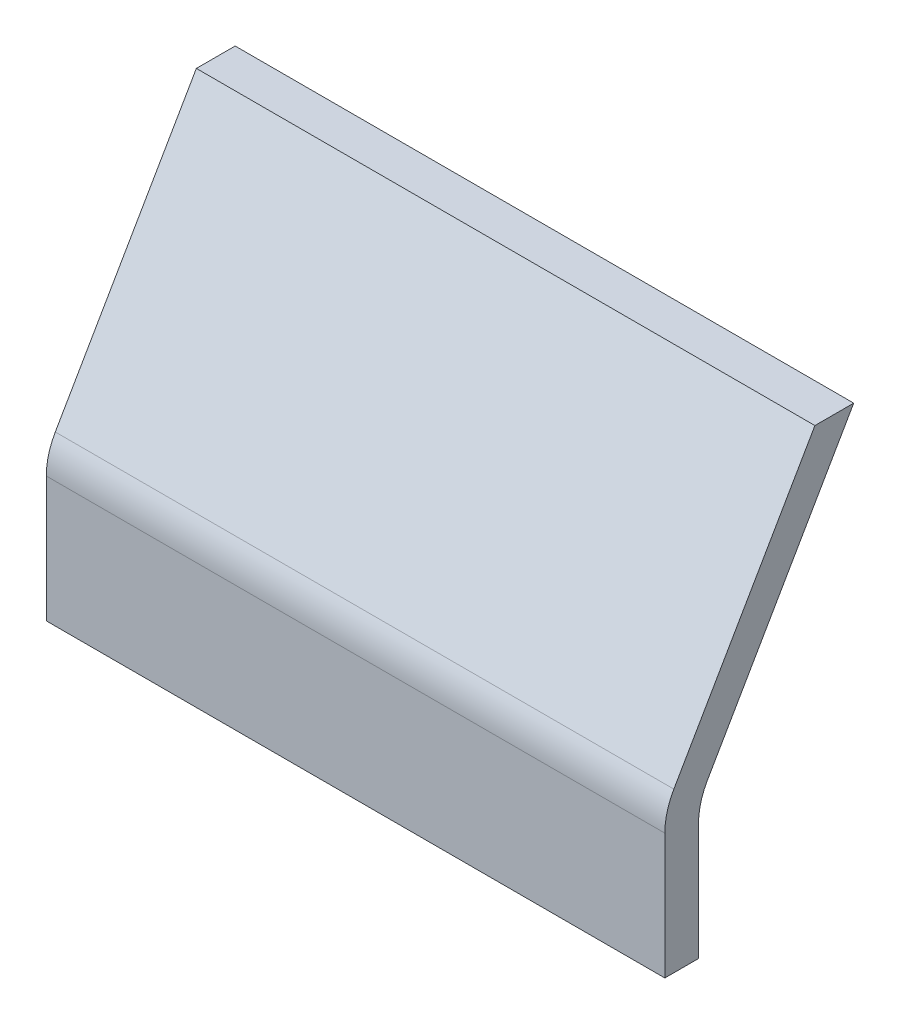
from build123d import *

# Parameters (mm, degrees)
BOSS_EXTRUDE1_DEPTH = 92
FILLET1_R           = 10
FILLET2_R           = 10


with BuildPart() as part:
    # Sketch1 → Boss-Extrude1 (new body)
    with BuildSketch(Plane(origin=(0, 0, 0), x_dir=(0, 0, -1), z_dir=(1, 0, 0))):
        Polygon((0, 0), (0, 21.339745962), (22.320508076, 60), (28.094010768, 60), (5, 20), (5, 0), align=None)
    extrude(amount=BOSS_EXTRUDE1_DEPTH)

    # Fillet1
    fillet1_edges = [part.edges().sort_by_distance(p)[0] for p in [
        (46, 21.339745962, 0),
    ]]
    fillet(fillet1_edges, radius=FILLET1_R)

    # Fillet2
    fillet2_edges = [part.edges().sort_by_distance(p)[0] for p in [
        (46, 20, -5),
    ]]
    fillet(fillet2_edges, radius=FILLET2_R)


solid = part.part
